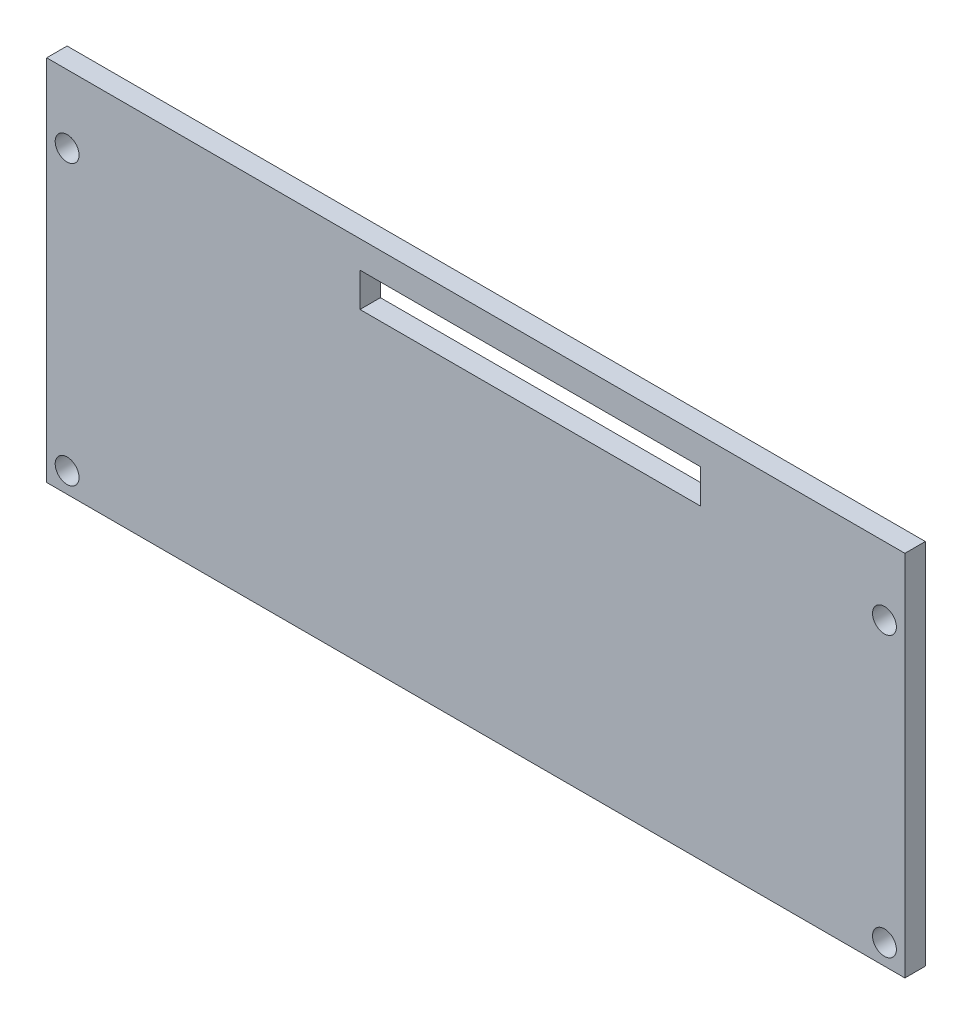
from build123d import *

# Parameters (mm, degrees)
SKETCH1_W           = 126
SKETCH1_H           = 54
SKETCH1_R           = 1.75
SKETCH1_W_2         = 50
SKETCH1_H_2         = 5
BOSS_EXTRUDE1_DEPTH = 3


with BuildPart() as part:
    # Sketch1 → Boss-Extrude1 (new body)
    with BuildSketch(Plane.XY):
        with Locations((0, -2)):
            Rectangle(SKETCH1_W, SKETCH1_H)
        with Locations((-60, 15)):
            Circle(SKETCH1_R, mode=Mode.SUBTRACT)
        with Locations((60, 15)):
            Circle(SKETCH1_R, mode=Mode.SUBTRACT)
        with Locations((60, -26)):
            Circle(SKETCH1_R, mode=Mode.SUBTRACT)
        with Locations((-60, -26)):
            Circle(SKETCH1_R, mode=Mode.SUBTRACT)
        with Locations((8, 18.5)):
            Rectangle(SKETCH1_W_2, SKETCH1_H_2, mode=Mode.SUBTRACT)
    extrude(amount=BOSS_EXTRUDE1_DEPTH)


solid = part.part
